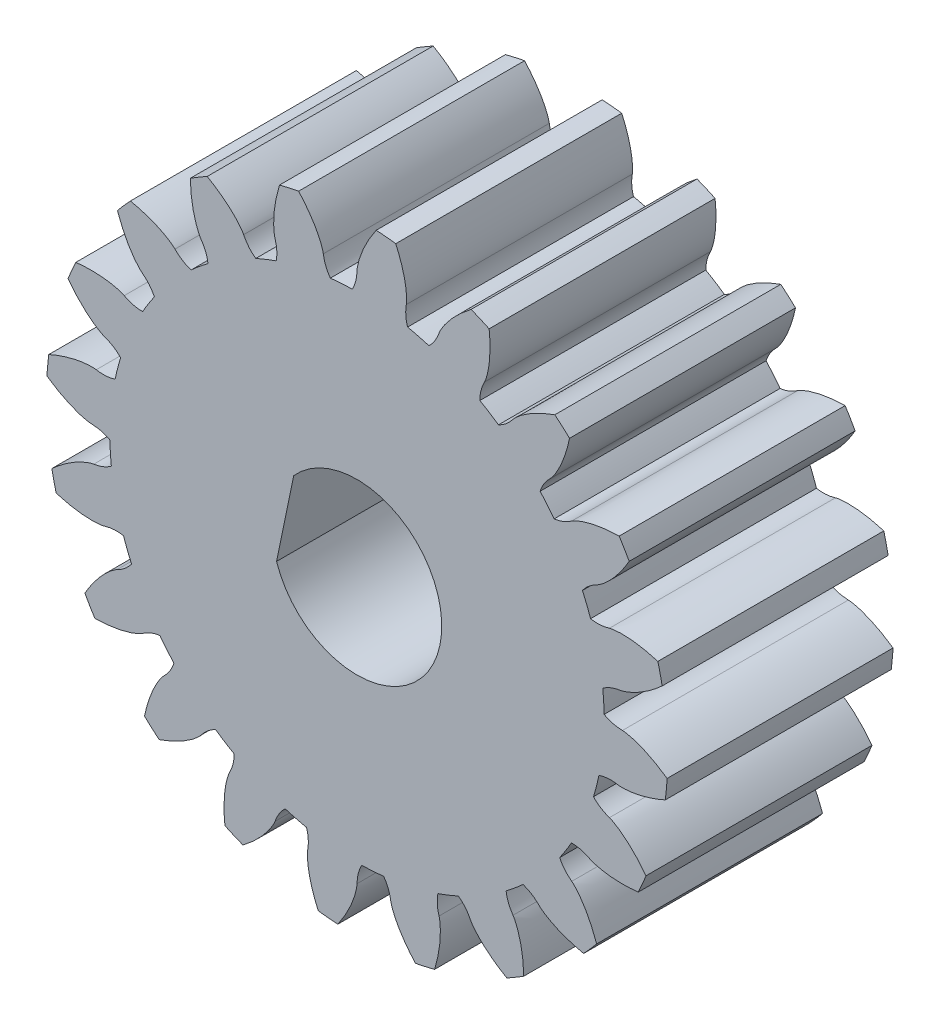
from build123d import *

# Parameters (mm, degrees)
EXTRUDE_1_DEPTH     = 8
SKETCH_5_R          = 1
CUT_EXTRUDE_1_DEPTH = 18.466428465
CUT_EXTRUDE_2_DEPTH = 18.466428465


with BuildPart() as part:
    # 草图4 → 凸台-拉伸1 (new body)
    with BuildSketch(Plane.XY):
        with BuildLine():
            ThreePointArc((2.543905939, 8.372039332), (2.169123392, 8.476874643), (1.790049985, 8.564941392))
            add(Edge.make_bspline(
                [(1.745749063, 9.233340802), (1.707740284, 9.004921116), (1.717265608, 8.783030501), (1.790049985, 8.564941392)],
                knots=[0, 0, 0, 0, 1, 1, 1, 1], degree=3))
            add(Edge.make_bspline(
                [(1.745749063, 9.233340802), (1.746999875, 9.240857749), (1.749991316, 9.262019744), (1.753602304, 9.302312656), (1.756572018, 9.368303719), (1.756057467, 9.452623023), (1.750449874, 9.561647495), (1.73749906, 9.689919098), (1.716635619, 9.830441145), (1.686820894, 9.982561877), (1.650814565, 10.133435989), (1.60911474, 10.282912942), (1.562384587, 10.430760302), (1.499754659, 10.608275298), (1.444797811, 10.746961244), (1.401215275, 10.848621675), (1.371830669, 10.914122989)],
                knots=[0, 0, 0, 0, 0, 0.005376748, 0.015083688, 0.02853182, 0.046610139, 0.064854849, 0.092110525, 0.119476175, 0.146842495, 0.174208853, 0.201574955, 0.228941013, 0.256307345, 0.306946889, 0.306946889, 0.306946889, 0.306946889, 0.306946889], degree=4))
            ThreePointArc((1.371830669, 10.914122989), (1.026259185, 10.952022283), (0.679662663, 10.978982588))
            add(Edge.make_bspline(
                [(0, 9.396926208), (0.000167452, 9.404544671), (0.001159536, 9.425894016), (0.005096976, 9.466156338), (0.014438695, 9.531550312), (0.030609023, 9.61430616), (0.056373425, 9.720390918), (0.092928922, 9.844023533), (0.139535173, 9.978223333), (0.197091668, 10.122156946), (0.260500386, 10.263715372), (0.329243924, 10.40284323), (0.402627475, 10.539435336), (0.497145628, 10.702224771), (0.576910665, 10.828286604), (0.638620845, 10.920080582), (0.679662663, 10.978982588)],
                knots=[0, 0, 0, 0, 0, 0.005376748, 0.015083688, 0.02853182, 0.046610139, 0.064854849, 0.092110525, 0.119476175, 0.146842495, 0.174208853, 0.201574955, 0.228941013, 0.256307345, 0.306946889, 0.306946889, 0.306946889, 0.306946889, 0.306946889], degree=4))
            add(Edge.make_bspline(
                [(0, 9.396926208), (-0.005088413, 9.165421719), (-0.055670474, 8.949163467), (-0.16770411, 8.748392728)],
                knots=[0, 0, 0, 0, 1, 1, 1, 1], degree=3))
            ThreePointArc((-0.16770411, 8.748392728), (-0.556539387, 8.732282858), (-0.944273743, 8.698899189))
            add(Edge.make_bspline(
                [(-1.1929532, 9.320895065), (-1.158516132, 9.091909676), (-1.08088904, 8.883822648), (-0.944273743, 8.698899189)],
                knots=[0, 0, 0, 0, 1, 1, 1, 1], degree=3))
            add(Edge.make_bspline(
                [(-1.1929532, 9.320895065), (-1.194086472, 9.328430628), (-1.197780859, 9.349481288), (-1.2067978, 9.388917981), (-1.224365793, 9.452596904), (-1.250911259, 9.532630323), (-1.289934811, 9.634585915), (-1.341889872, 9.752577437), (-1.405155885, 9.879774688), (-1.480519264, 10.015236845), (-1.561385983, 10.147600085), (-1.647235792, 10.276875161), (-1.737366156, 10.403045944), (-1.851785907, 10.552519025), (-1.946909289, 10.667434599), (-2.019773545, 10.75065167), (-2.067960985, 10.803866778)],
                knots=[0, 0, 0, 0, 0, 0.005376748, 0.015083688, 0.02853182, 0.046610139, 0.064854849, 0.092110525, 0.119476175, 0.146842495, 0.174208853, 0.201574955, 0.228941013, 0.256307345, 0.306946889, 0.306946889, 0.306946889, 0.306946889, 0.306946889], degree=4))
            ThreePointArc((-2.067960985, 10.803866778), (-2.408330523, 10.733123688), (-2.746294596, 10.651660246))
            add(Edge.make_bspline(
                [(-2.903809893, 8.937007903), (-2.906004871, 8.944305237), (-2.911658654, 8.964916242), (-2.920355668, 9.004424721), (-2.931679014, 9.069504836), (-2.941873082, 9.153207231), (-2.950151673, 9.26206147), (-2.953589908, 9.390939344), (-2.950734748, 9.532973062), (-2.940473201, 9.687647997), (-2.923911886, 9.841872432), (-2.901525769, 9.995433809), (-2.873943146, 10.148017386), (-2.834355743, 10.332047055), (-2.797449934, 10.476587735), (-2.767125964, 10.58295849), (-2.746294596, 10.651660246)],
                knots=[0, 0, 0, 0, 0, 0.005376748, 0.015083688, 0.02853182, 0.046610139, 0.064854849, 0.092110525, 0.119476175, 0.146842495, 0.174208853, 0.201574955, 0.228941013, 0.256307345, 0.306946889, 0.306946889, 0.306946889, 0.306946889, 0.306946889], degree=4))
            add(Edge.make_bspline(
                [(-2.903809893, 8.937007903), (-2.83711044, 8.715261644), (-2.818389364, 8.493957108), (-2.862898114, 8.268392491)],
                knots=[0, 0, 0, 0, 1, 1, 1, 1], degree=3))
            ThreePointArc((-2.862898114, 8.268392491), (-3.227724213, 8.132914385), (-3.586165378, 7.981348124))
            add(Edge.make_bspline(
                [(-4.014880893, 8.496055177), (-3.911368918, 8.28891877), (-3.773238738, 8.115004336), (-3.586165378, 7.981348124)],
                knots=[0, 0, 0, 0, 1, 1, 1, 1], degree=3))
            add(Edge.make_bspline(
                [(-4.014880893, 8.496055177), (-4.018287315, 8.502871723), (-4.028305898, 8.521750462), (-4.049068126, 8.556470598), (-4.08545415, 8.611604044), (-4.135432075, 8.679517349), (-4.204051689, 8.764423938), (-4.289925274, 8.860585548), (-4.38940094, 8.962007049), (-4.502935881, 9.067550651), (-4.620747192, 9.168446383), (-4.742343408, 9.264865235), (-4.867051393, 9.357008967), (-5.022060766, 9.463808667), (-5.148039343, 9.543705131), (-5.243052858, 9.600332975), (-5.30532621, 9.636052813)],
                knots=[0, 0, 0, 0, 0, 0.005376748, 0.015083688, 0.02853182, 0.046610139, 0.064854849, 0.092110525, 0.119476175, 0.146842495, 0.174208853, 0.201574955, 0.228941013, 0.256307345, 0.306946889, 0.306946889, 0.306946889, 0.306946889, 0.306946889], degree=4))
            ThreePointArc((-5.30532621, 9.636052813), (-5.607176059, 9.463592164), (-5.903425405, 9.281679185))
            add(Edge.make_bspline(
                [(-5.523374642, 7.602272997), (-5.52771719, 7.608534889), (-5.539463408, 7.626390005), (-5.559943551, 7.661277276), (-5.590823555, 7.719673037), (-5.626384152, 7.796128605), (-5.66789537, 7.897096913), (-5.710990779, 8.018604581), (-5.752166193, 8.154568967), (-5.790204066, 8.304844564), (-5.82211129, 8.456638446), (-5.848273903, 8.609601685), (-5.869192188, 8.76324079), (-5.888410625, 8.950496586), (-5.897976642, 9.099367463), (-5.902007203, 9.209902685), (-5.903425405, 9.281679185)],
                knots=[0, 0, 0, 0, 0, 0.005376748, 0.015083688, 0.02853182, 0.046610139, 0.064854849, 0.092110525, 0.119476175, 0.146842495, 0.174208853, 0.201574955, 0.228941013, 0.256307345, 0.306946889, 0.306946889, 0.306946889, 0.306946889, 0.306946889], degree=4))
            add(Edge.make_bspline(
                [(-5.523374642, 7.602272997), (-5.39141633, 7.411991037), (-5.305224666, 7.207303046), (-5.277851702, 6.979024388)],
                knots=[0, 0, 0, 0, 1, 1, 1, 1], degree=3))
            ThreePointArc((-5.277851702, 6.979024388), (-5.582956905, 6.737439588), (-5.87701816, 6.482527096))
            add(Edge.make_bspline(
                [(-6.44380407, 6.839562213), (-6.281349662, 6.674550742), (-6.096237539, 6.55183286), (-5.87701816, 6.482527096)],
                knots=[0, 0, 0, 0, 1, 1, 1, 1], degree=3))
            add(Edge.make_bspline(
                [(-6.44380407, 6.839562213), (-6.449150199, 6.844992491), (-6.464512288, 6.859851327), (-6.494987453, 6.886456257), (-6.54662979, 6.927647379), (-6.615147986, 6.976792743), (-6.706646696, 7.036339081), (-6.8180329, 7.101257809), (-6.943980848, 7.166975717), (-7.084573761, 7.232269421), (-7.227797471, 7.291821267), (-7.373237409, 7.345945749), (-7.52031573, 7.395042758), (-7.700741326, 7.448714778), (-7.845243438, 7.485771309), (-7.953105627, 7.510266799), (-8.023369141, 7.524994859)],
                knots=[0, 0, 0, 0, 0, 0.005376748, 0.015083688, 0.02853182, 0.046610139, 0.064854849, 0.092110525, 0.119476175, 0.146842495, 0.174208853, 0.201574955, 0.228941013, 0.256307345, 0.306946889, 0.306946889, 0.306946889, 0.306946889, 0.306946889], degree=4))
            ThreePointArc((-8.023369141, 7.524994859), (-8.257152136, 7.267698302), (-8.482687804, 7.003142695))
            add(Edge.make_bspline(
                [(-7.602272997, 5.523374642), (-7.608338037, 5.527988134), (-7.625026888, 5.541339577), (-7.655285421, 5.568190631), (-7.702699333, 5.614185854), (-7.76014554, 5.675910591), (-7.830825977, 5.759109487), (-7.909360081, 5.861352933), (-7.990535534, 5.977938845), (-8.073149413, 6.109105083), (-8.150401876, 6.243609769), (-8.22255224, 6.381001762), (-8.289923805, 6.520657128), (-8.366066849, 6.692809149), (-8.421168302, 6.831437705), (-8.459158856, 6.935317436), (-8.482687804, 7.003142695)],
                knots=[0, 0, 0, 0, 0, 0.005376748, 0.015083688, 0.02853182, 0.046610139, 0.064854849, 0.092110525, 0.119476175, 0.146842495, 0.174208853, 0.201574955, 0.228941013, 0.256307345, 0.306946889, 0.306946889, 0.306946889, 0.306946889, 0.306946889], degree=4))
            add(Edge.make_bspline(
                [(-7.602272997, 5.523374642), (-7.417972826, 5.383183105), (-7.272747614, 5.215147946), (-7.176172394, 5.006500752)],
                knots=[0, 0, 0, 0, 1, 1, 1, 1], degree=3))
            ThreePointArc((-7.176172394, 5.006500752), (-7.391690876, 4.682457261), (-7.592587457, 4.349151149))
            add(Edge.make_bspline(
                [(-8.241962808, 4.513565245), (-8.036468136, 4.406831183), (-7.822494134, 4.347322334), (-7.592587457, 4.349151149)],
                knots=[0, 0, 0, 0, 1, 1, 1, 1], degree=3))
            add(Edge.make_bspline(
                [(-8.241962808, 4.513565245), (-8.248725327, 4.517077702), (-8.267927175, 4.526462148), (-8.305132155, 4.542347596), (-8.366975693, 4.565564322), (-8.447327122, 4.591131053), (-8.552748397, 4.619488329), (-8.678743963, 4.646809479), (-8.81883553, 4.670390867), (-8.9727242, 4.689043271), (-9.127340575, 4.701421882), (-9.28238756, 4.70795391), (-9.437439166, 4.70919824), (-9.625619671, 4.704488789), (-9.774500445, 4.695078036), (-9.884653004, 4.685043381), (-9.956028798, 4.677337979)],
                knots=[0, 0, 0, 0, 0, 0.005376748, 0.015083688, 0.02853182, 0.046610139, 0.064854849, 0.092110525, 0.119476175, 0.146842495, 0.174208853, 0.201574955, 0.228941013, 0.256307345, 0.306946889, 0.306946889, 0.306946889, 0.306946889, 0.306946889], degree=4))
            ThreePointArc((-9.956028798, 4.677337979), (-10.09886063, 4.360391494), (-10.231605619, 4.039089805))
            add(Edge.make_bspline(
                [(-8.937007903, 2.903809893), (-8.944201746, 2.906323384), (-8.96419961, 2.913864223), (-9.001274617, 2.930050692), (-9.060581232, 2.959143044), (-9.134289815, 3.000094903), (-9.227220778, 3.057380299), (-9.333506111, 3.130351221), (-9.446735583, 3.216146419), (-9.565838647, 3.315363831), (-9.680874339, 3.419413065), (-9.791949874, 3.527784927), (-9.899179922, 3.639786114), (-10.02479416, 3.779982921), (-10.120037336, 3.894799228), (-10.188269102, 3.981854996), (-10.231605619, 4.039089805)],
                knots=[0, 0, 0, 0, 0, 0.005376748, 0.015083688, 0.02853182, 0.046610139, 0.064854849, 0.092110525, 0.119476175, 0.146842495, 0.174208853, 0.201574955, 0.228941013, 0.256307345, 0.306946889, 0.306946889, 0.306946889, 0.306946889, 0.306946889], degree=4))
            add(Edge.make_bspline(
                [(-8.937007903, 2.903809893), (-8.718406457, 2.827431703), (-8.528363353, 2.712497829), (-8.372039332, 2.543905939)],
                knots=[0, 0, 0, 0, 1, 1, 1, 1], degree=3))
            ThreePointArc((-8.372039332, 2.543905939), (-8.476874643, 2.169123392), (-8.564941392, 1.790049985))
            add(Edge.make_bspline(
                [(-9.233340802, 1.745749063), (-9.004921116, 1.707740284), (-8.783030501, 1.717265608), (-8.564941392, 1.790049985)],
                knots=[0, 0, 0, 0, 1, 1, 1, 1], degree=3))
            add(Edge.make_bspline(
                [(-9.233340802, 1.745749063), (-9.240857749, 1.746999875), (-9.262019744, 1.749991316), (-9.302312656, 1.753602304), (-9.368303719, 1.756572018), (-9.452623023, 1.756057467), (-9.561647495, 1.750449874), (-9.689919098, 1.73749906), (-9.830441145, 1.716635619), (-9.982561877, 1.686820894), (-10.133435989, 1.650814565), (-10.282912942, 1.60911474), (-10.430760302, 1.562384587), (-10.608275298, 1.499754659), (-10.746961244, 1.444797811), (-10.848621675, 1.401215275), (-10.914122989, 1.371830669)],
                knots=[0, 0, 0, 0, 0, 0.005376748, 0.015083688, 0.02853182, 0.046610139, 0.064854849, 0.092110525, 0.119476175, 0.146842495, 0.174208853, 0.201574955, 0.228941013, 0.256307345, 0.306946889, 0.306946889, 0.306946889, 0.306946889, 0.306946889], degree=4))
            ThreePointArc((-10.914122989, 1.371830669), (-10.952022283, 1.026259185), (-10.978982588, 0.679662663))
            add(Edge.make_bspline(
                [(-9.396926208, 0), (-9.404544671, 0.000167452), (-9.425894016, 0.001159536), (-9.466156338, 0.005096976), (-9.531550312, 0.014438695), (-9.61430616, 0.030609023), (-9.720390918, 0.056373425), (-9.844023533, 0.092928922), (-9.978223333, 0.139535173), (-10.122156946, 0.197091668), (-10.263715372, 0.260500386), (-10.40284323, 0.329243924), (-10.539435336, 0.402627475), (-10.702224771, 0.497145628), (-10.828286604, 0.576910665), (-10.920080582, 0.638620845), (-10.978982588, 0.679662663)],
                knots=[0, 0, 0, 0, 0, 0.005376748, 0.015083688, 0.02853182, 0.046610139, 0.064854849, 0.092110525, 0.119476175, 0.146842495, 0.174208853, 0.201574955, 0.228941013, 0.256307345, 0.306946889, 0.306946889, 0.306946889, 0.306946889, 0.306946889], degree=4))
            add(Edge.make_bspline(
                [(-9.396926208, 0), (-9.165421719, -0.005088413), (-8.949163467, -0.055670474), (-8.748392728, -0.16770411)],
                knots=[0, 0, 0, 0, 1, 1, 1, 1], degree=3))
            ThreePointArc((-8.748392728, -0.16770411), (-8.732282858, -0.556539387), (-8.698899189, -0.944273743))
            add(Edge.make_bspline(
                [(-9.320895065, -1.1929532), (-9.091909676, -1.158516132), (-8.883822648, -1.08088904), (-8.698899189, -0.944273743)],
                knots=[0, 0, 0, 0, 1, 1, 1, 1], degree=3))
            add(Edge.make_bspline(
                [(-9.320895065, -1.1929532), (-9.328430628, -1.194086472), (-9.349481288, -1.197780859), (-9.388917981, -1.2067978), (-9.452596904, -1.224365793), (-9.532630323, -1.250911259), (-9.634585915, -1.289934811), (-9.752577437, -1.341889872), (-9.879774688, -1.405155885), (-10.015236845, -1.480519264), (-10.147600085, -1.561385983), (-10.276875161, -1.647235792), (-10.403045944, -1.737366156), (-10.552519025, -1.851785907), (-10.667434599, -1.946909289), (-10.75065167, -2.019773545), (-10.803866778, -2.067960985)],
                knots=[0, 0, 0, 0, 0, 0.005376748, 0.015083688, 0.02853182, 0.046610139, 0.064854849, 0.092110525, 0.119476175, 0.146842495, 0.174208853, 0.201574955, 0.228941013, 0.256307345, 0.306946889, 0.306946889, 0.306946889, 0.306946889, 0.306946889], degree=4))
            ThreePointArc((-10.803866778, -2.067960985), (-10.733123688, -2.408330523), (-10.651660246, -2.746294596))
            add(Edge.make_bspline(
                [(-8.937007903, -2.903809893), (-8.944305237, -2.906004871), (-8.964916242, -2.911658654), (-9.004424721, -2.920355668), (-9.069504836, -2.931679014), (-9.153207231, -2.941873082), (-9.26206147, -2.950151673), (-9.390939344, -2.953589908), (-9.532973062, -2.950734748), (-9.687647997, -2.940473201), (-9.841872432, -2.923911886), (-9.995433809, -2.901525769), (-10.148017386, -2.873943146), (-10.332047055, -2.834355743), (-10.476587735, -2.797449934), (-10.58295849, -2.767125964), (-10.651660246, -2.746294596)],
                knots=[0, 0, 0, 0, 0, 0.005376748, 0.015083688, 0.02853182, 0.046610139, 0.064854849, 0.092110525, 0.119476175, 0.146842495, 0.174208853, 0.201574955, 0.228941013, 0.256307345, 0.306946889, 0.306946889, 0.306946889, 0.306946889, 0.306946889], degree=4))
            add(Edge.make_bspline(
                [(-8.937007903, -2.903809893), (-8.715261644, -2.83711044), (-8.493957108, -2.818389364), (-8.268392491, -2.862898114)],
                knots=[0, 0, 0, 0, 1, 1, 1, 1], degree=3))
            ThreePointArc((-8.268392491, -2.862898114), (-8.132914385, -3.227724213), (-7.981348124, -3.586165378))
            add(Edge.make_bspline(
                [(-8.496055177, -4.014880893), (-8.28891877, -3.911368918), (-8.115004336, -3.773238738), (-7.981348124, -3.586165378)],
                knots=[0, 0, 0, 0, 1, 1, 1, 1], degree=3))
            add(Edge.make_bspline(
                [(-8.496055177, -4.014880893), (-8.502871723, -4.018287315), (-8.521750462, -4.028305898), (-8.556470598, -4.049068126), (-8.611604044, -4.08545415), (-8.679517349, -4.135432075), (-8.764423938, -4.204051689), (-8.860585548, -4.289925274), (-8.962007049, -4.38940094), (-9.067550651, -4.502935881), (-9.168446383, -4.620747192), (-9.264865235, -4.742343408), (-9.357008967, -4.867051393), (-9.463808667, -5.022060766), (-9.543705131, -5.148039343), (-9.600332975, -5.243052858), (-9.636052813, -5.30532621)],
                knots=[0, 0, 0, 0, 0, 0.005376748, 0.015083688, 0.02853182, 0.046610139, 0.064854849, 0.092110525, 0.119476175, 0.146842495, 0.174208853, 0.201574955, 0.228941013, 0.256307345, 0.306946889, 0.306946889, 0.306946889, 0.306946889, 0.306946889], degree=4))
            ThreePointArc((-9.636052813, -5.30532621), (-9.463592164, -5.607176059), (-9.281679185, -5.903425405))
            add(Edge.make_bspline(
                [(-7.602272997, -5.523374642), (-7.608534889, -5.52771719), (-7.626390005, -5.539463408), (-7.661277276, -5.559943551), (-7.719673037, -5.590823555), (-7.796128605, -5.626384152), (-7.897096913, -5.66789537), (-8.018604581, -5.710990779), (-8.154568967, -5.752166193), (-8.304844564, -5.790204066), (-8.456638446, -5.82211129), (-8.609601685, -5.848273903), (-8.76324079, -5.869192188), (-8.950496586, -5.888410625), (-9.099367463, -5.897976642), (-9.209902685, -5.902007203), (-9.281679185, -5.903425405)],
                knots=[0, 0, 0, 0, 0, 0.005376748, 0.015083688, 0.02853182, 0.046610139, 0.064854849, 0.092110525, 0.119476175, 0.146842495, 0.174208853, 0.201574955, 0.228941013, 0.256307345, 0.306946889, 0.306946889, 0.306946889, 0.306946889, 0.306946889], degree=4))
            add(Edge.make_bspline(
                [(-7.602272997, -5.523374642), (-7.411991037, -5.39141633), (-7.207303046, -5.305224666), (-6.979024388, -5.277851702)],
                knots=[0, 0, 0, 0, 1, 1, 1, 1], degree=3))
            ThreePointArc((-6.979024388, -5.277851702), (-6.737439588, -5.582956905), (-6.482527096, -5.87701816))
            add(Edge.make_bspline(
                [(-6.839562213, -6.44380407), (-6.674550742, -6.281349662), (-6.55183286, -6.096237539), (-6.482527096, -5.87701816)],
                knots=[0, 0, 0, 0, 1, 1, 1, 1], degree=3))
            add(Edge.make_bspline(
                [(-6.839562213, -6.44380407), (-6.844992491, -6.449150199), (-6.859851327, -6.464512288), (-6.886456257, -6.494987453), (-6.927647379, -6.54662979), (-6.976792743, -6.615147986), (-7.036339081, -6.706646696), (-7.101257809, -6.8180329), (-7.166975717, -6.943980848), (-7.232269421, -7.084573761), (-7.291821267, -7.227797471), (-7.345945749, -7.373237409), (-7.395042758, -7.52031573), (-7.448714778, -7.700741326), (-7.485771309, -7.845243438), (-7.510266799, -7.953105627), (-7.524994859, -8.023369141)],
                knots=[0, 0, 0, 0, 0, 0.005376748, 0.015083688, 0.02853182, 0.046610139, 0.064854849, 0.092110525, 0.119476175, 0.146842495, 0.174208853, 0.201574955, 0.228941013, 0.256307345, 0.306946889, 0.306946889, 0.306946889, 0.306946889, 0.306946889], degree=4))
            ThreePointArc((-7.524994859, -8.023369141), (-7.267698302, -8.257152136), (-7.003142695, -8.482687804))
            add(Edge.make_bspline(
                [(-5.523374642, -7.602272997), (-5.527988134, -7.608338037), (-5.541339577, -7.625026888), (-5.568190631, -7.655285421), (-5.614185854, -7.702699333), (-5.675910591, -7.76014554), (-5.759109487, -7.830825977), (-5.861352933, -7.909360081), (-5.977938845, -7.990535534), (-6.109105083, -8.073149413), (-6.243609769, -8.150401876), (-6.381001762, -8.22255224), (-6.520657128, -8.289923805), (-6.692809149, -8.366066849), (-6.831437705, -8.421168302), (-6.935317436, -8.459158856), (-7.003142695, -8.482687804)],
                knots=[0, 0, 0, 0, 0, 0.005376748, 0.015083688, 0.02853182, 0.046610139, 0.064854849, 0.092110525, 0.119476175, 0.146842495, 0.174208853, 0.201574955, 0.228941013, 0.256307345, 0.306946889, 0.306946889, 0.306946889, 0.306946889, 0.306946889], degree=4))
            add(Edge.make_bspline(
                [(-5.523374642, -7.602272997), (-5.383183105, -7.417972826), (-5.215147946, -7.272747614), (-5.006500752, -7.176172394)],
                knots=[0, 0, 0, 0, 1, 1, 1, 1], degree=3))
            ThreePointArc((-5.006500752, -7.176172394), (-4.68245726, -7.391690876), (-4.349151149, -7.592587457))
            add(Edge.make_bspline(
                [(-4.513565245, -8.241962808), (-4.406831183, -8.036468136), (-4.347322334, -7.822494134), (-4.349151149, -7.592587457)],
                knots=[0, 0, 0, 0, 1, 1, 1, 1], degree=3))
            add(Edge.make_bspline(
                [(-4.513565245, -8.241962808), (-4.517077702, -8.248725327), (-4.526462148, -8.267927175), (-4.542347596, -8.305132155), (-4.565564322, -8.366975693), (-4.591131053, -8.447327122), (-4.619488329, -8.552748397), (-4.646809479, -8.678743963), (-4.670390867, -8.81883553), (-4.689043271, -8.9727242), (-4.701421882, -9.127340575), (-4.70795391, -9.28238756), (-4.70919824, -9.437439166), (-4.704488789, -9.625619671), (-4.695078036, -9.774500445), (-4.685043381, -9.884653004), (-4.677337979, -9.956028798)],
                knots=[0, 0, 0, 0, 0, 0.005376748, 0.015083688, 0.02853182, 0.046610139, 0.064854849, 0.092110525, 0.119476175, 0.146842495, 0.174208853, 0.201574955, 0.228941013, 0.256307345, 0.306946889, 0.306946889, 0.306946889, 0.306946889, 0.306946889], degree=4))
            ThreePointArc((-4.677337979, -9.956028798), (-4.360391494, -10.09886063), (-4.039089805, -10.231605619))
            add(Edge.make_bspline(
                [(-2.903809893, -8.937007903), (-2.906323384, -8.944201746), (-2.913864223, -8.96419961), (-2.930050692, -9.001274617), (-2.959143044, -9.060581232), (-3.000094903, -9.134289815), (-3.057380299, -9.227220778), (-3.130351221, -9.333506111), (-3.216146419, -9.446735583), (-3.315363831, -9.565838647), (-3.419413065, -9.680874339), (-3.527784927, -9.791949874), (-3.639786114, -9.899179922), (-3.779982921, -10.02479416), (-3.894799228, -10.120037336), (-3.981854996, -10.188269102), (-4.039089805, -10.231605619)],
                knots=[0, 0, 0, 0, 0, 0.005376748, 0.015083688, 0.02853182, 0.046610139, 0.064854849, 0.092110525, 0.119476175, 0.146842495, 0.174208853, 0.201574955, 0.228941013, 0.256307345, 0.306946889, 0.306946889, 0.306946889, 0.306946889, 0.306946889], degree=4))
            add(Edge.make_bspline(
                [(-2.903809893, -8.937007903), (-2.827431703, -8.718406457), (-2.712497829, -8.528363353), (-2.543905939, -8.372039332)],
                knots=[0, 0, 0, 0, 1, 1, 1, 1], degree=3))
            ThreePointArc((-2.543905939, -8.372039332), (-2.169123392, -8.476874643), (-1.790049985, -8.564941392))
            add(Edge.make_bspline(
                [(-1.745749063, -9.233340802), (-1.707740284, -9.004921116), (-1.717265608, -8.783030501), (-1.790049985, -8.564941392)],
                knots=[0, 0, 0, 0, 1, 1, 1, 1], degree=3))
            add(Edge.make_bspline(
                [(-1.745749063, -9.233340802), (-1.746999875, -9.240857749), (-1.749991316, -9.262019744), (-1.753602304, -9.302312656), (-1.756572018, -9.368303719), (-1.756057467, -9.452623023), (-1.750449874, -9.561647495), (-1.73749906, -9.689919098), (-1.716635619, -9.830441145), (-1.686820894, -9.982561877), (-1.650814565, -10.133435989), (-1.60911474, -10.282912942), (-1.562384587, -10.430760302), (-1.499754659, -10.608275298), (-1.444797811, -10.746961244), (-1.401215275, -10.848621675), (-1.371830669, -10.914122989)],
                knots=[0, 0, 0, 0, 0, 0.005376748, 0.015083688, 0.02853182, 0.046610139, 0.064854849, 0.092110525, 0.119476175, 0.146842495, 0.174208853, 0.201574955, 0.228941013, 0.256307345, 0.306946889, 0.306946889, 0.306946889, 0.306946889, 0.306946889], degree=4))
            ThreePointArc((-1.371830669, -10.914122989), (-1.026259185, -10.952022283), (-0.679662663, -10.978982588))
            add(Edge.make_bspline(
                [(0, -9.396926208), (-0.000167452, -9.404544671), (-0.001159536, -9.425894016), (-0.005096976, -9.466156338), (-0.014438695, -9.531550312), (-0.030609023, -9.61430616), (-0.056373425, -9.720390918), (-0.092928922, -9.844023533), (-0.139535173, -9.978223333), (-0.197091668, -10.122156946), (-0.260500386, -10.263715372), (-0.329243924, -10.40284323), (-0.402627475, -10.539435336), (-0.497145628, -10.702224771), (-0.576910665, -10.828286604), (-0.638620845, -10.920080582), (-0.679662663, -10.978982588)],
                knots=[0, 0, 0, 0, 0, 0.005376748, 0.015083688, 0.02853182, 0.046610139, 0.064854849, 0.092110525, 0.119476175, 0.146842495, 0.174208853, 0.201574955, 0.228941013, 0.256307345, 0.306946889, 0.306946889, 0.306946889, 0.306946889, 0.306946889], degree=4))
            add(Edge.make_bspline(
                [(0, -9.396926208), (0.005088413, -9.165421719), (0.055670474, -8.949163467), (0.16770411, -8.748392728)],
                knots=[0, 0, 0, 0, 1, 1, 1, 1], degree=3))
            ThreePointArc((0.16770411, -8.748392728), (0.556539387, -8.732282858), (0.944273743, -8.698899189))
            add(Edge.make_bspline(
                [(1.1929532, -9.320895065), (1.158516132, -9.091909676), (1.08088904, -8.883822648), (0.944273743, -8.698899189)],
                knots=[0, 0, 0, 0, 1, 1, 1, 1], degree=3))
            add(Edge.make_bspline(
                [(1.1929532, -9.320895065), (1.194086472, -9.328430628), (1.197780859, -9.349481288), (1.2067978, -9.388917981), (1.224365793, -9.452596904), (1.250911259, -9.532630323), (1.289934811, -9.634585915), (1.341889872, -9.752577437), (1.405155885, -9.879774688), (1.480519264, -10.015236845), (1.561385983, -10.147600085), (1.647235792, -10.276875161), (1.737366156, -10.403045944), (1.851785907, -10.552519025), (1.946909289, -10.667434599), (2.019773545, -10.75065167), (2.067960985, -10.803866778)],
                knots=[0, 0, 0, 0, 0, 0.005376748, 0.015083688, 0.02853182, 0.046610139, 0.064854849, 0.092110525, 0.119476175, 0.146842495, 0.174208853, 0.201574955, 0.228941013, 0.256307345, 0.306946889, 0.306946889, 0.306946889, 0.306946889, 0.306946889], degree=4))
            ThreePointArc((2.067960985, -10.803866778), (2.408330523, -10.733123688), (2.746294596, -10.651660246))
            add(Edge.make_bspline(
                [(2.903809893, -8.937007903), (2.906004871, -8.944305237), (2.911658654, -8.964916242), (2.920355668, -9.004424721), (2.931679014, -9.069504836), (2.941873082, -9.153207231), (2.950151673, -9.26206147), (2.953589908, -9.390939344), (2.950734748, -9.532973062), (2.940473201, -9.687647997), (2.923911886, -9.841872432), (2.901525769, -9.995433809), (2.873943146, -10.148017386), (2.834355743, -10.332047055), (2.797449934, -10.476587735), (2.767125964, -10.58295849), (2.746294596, -10.651660246)],
                knots=[0, 0, 0, 0, 0, 0.005376748, 0.015083688, 0.02853182, 0.046610139, 0.064854849, 0.092110525, 0.119476175, 0.146842495, 0.174208853, 0.201574955, 0.228941013, 0.256307345, 0.306946889, 0.306946889, 0.306946889, 0.306946889, 0.306946889], degree=4))
            add(Edge.make_bspline(
                [(2.903809893, -8.937007903), (2.83711044, -8.715261644), (2.818389364, -8.493957108), (2.862898114, -8.268392491)],
                knots=[0, 0, 0, 0, 1, 1, 1, 1], degree=3))
            ThreePointArc((2.862898114, -8.268392491), (3.227724213, -8.132914385), (3.586165378, -7.981348124))
            add(Edge.make_bspline(
                [(4.014880893, -8.496055177), (3.911368918, -8.28891877), (3.773238738, -8.115004336), (3.586165378, -7.981348124)],
                knots=[0, 0, 0, 0, 1, 1, 1, 1], degree=3))
            add(Edge.make_bspline(
                [(4.014880893, -8.496055177), (4.018287315, -8.502871723), (4.028305898, -8.521750462), (4.049068126, -8.556470598), (4.08545415, -8.611604044), (4.135432075, -8.679517349), (4.204051689, -8.764423938), (4.289925274, -8.860585548), (4.38940094, -8.962007049), (4.502935881, -9.067550651), (4.620747192, -9.168446383), (4.742343408, -9.264865235), (4.867051393, -9.357008967), (5.022060766, -9.463808667), (5.148039343, -9.543705131), (5.243052858, -9.600332975), (5.30532621, -9.636052813)],
                knots=[0, 0, 0, 0, 0, 0.005376748, 0.015083688, 0.02853182, 0.046610139, 0.064854849, 0.092110525, 0.119476175, 0.146842495, 0.174208853, 0.201574955, 0.228941013, 0.256307345, 0.306946889, 0.306946889, 0.306946889, 0.306946889, 0.306946889], degree=4))
            ThreePointArc((5.30532621, -9.636052813), (5.607176059, -9.463592164), (5.903425405, -9.281679185))
            add(Edge.make_bspline(
                [(5.523374642, -7.602272997), (5.52771719, -7.608534889), (5.539463408, -7.626390005), (5.559943551, -7.661277276), (5.590823555, -7.719673037), (5.626384152, -7.796128605), (5.66789537, -7.897096913), (5.710990779, -8.018604581), (5.752166193, -8.154568967), (5.790204066, -8.304844564), (5.82211129, -8.456638446), (5.848273903, -8.609601685), (5.869192188, -8.76324079), (5.888410625, -8.950496586), (5.897976642, -9.099367463), (5.902007203, -9.209902685), (5.903425405, -9.281679185)],
                knots=[0, 0, 0, 0, 0, 0.005376748, 0.015083688, 0.02853182, 0.046610139, 0.064854849, 0.092110525, 0.119476175, 0.146842495, 0.174208853, 0.201574955, 0.228941013, 0.256307345, 0.306946889, 0.306946889, 0.306946889, 0.306946889, 0.306946889], degree=4))
            add(Edge.make_bspline(
                [(5.523374642, -7.602272997), (5.39141633, -7.411991037), (5.305224666, -7.207303046), (5.277851702, -6.979024388)],
                knots=[0, 0, 0, 0, 1, 1, 1, 1], degree=3))
            ThreePointArc((5.277851702, -6.979024388), (5.582956905, -6.737439588), (5.87701816, -6.482527096))
            add(Edge.make_bspline(
                [(6.44380407, -6.839562213), (6.281349662, -6.674550742), (6.096237539, -6.55183286), (5.87701816, -6.482527096)],
                knots=[0, 0, 0, 0, 1, 1, 1, 1], degree=3))
            add(Edge.make_bspline(
                [(6.44380407, -6.839562213), (6.449150199, -6.844992491), (6.464512288, -6.859851327), (6.494987453, -6.886456257), (6.54662979, -6.927647379), (6.615147986, -6.976792743), (6.706646696, -7.036339081), (6.8180329, -7.101257809), (6.943980848, -7.166975717), (7.084573761, -7.232269421), (7.227797471, -7.291821267), (7.373237409, -7.345945749), (7.52031573, -7.395042758), (7.700741326, -7.448714778), (7.845243438, -7.485771309), (7.953105627, -7.510266799), (8.023369141, -7.524994859)],
                knots=[0, 0, 0, 0, 0, 0.005376748, 0.015083688, 0.02853182, 0.046610139, 0.064854849, 0.092110525, 0.119476175, 0.146842495, 0.174208853, 0.201574955, 0.228941013, 0.256307345, 0.306946889, 0.306946889, 0.306946889, 0.306946889, 0.306946889], degree=4))
            ThreePointArc((8.023369141, -7.524994859), (8.257152136, -7.267698302), (8.482687804, -7.003142695))
            add(Edge.make_bspline(
                [(7.602272997, -5.523374642), (7.608338037, -5.527988133), (7.625026888, -5.541339577), (7.655285421, -5.568190631), (7.702699333, -5.614185854), (7.76014554, -5.675910591), (7.830825977, -5.759109487), (7.909360081, -5.861352933), (7.990535534, -5.977938845), (8.073149413, -6.109105083), (8.150401876, -6.243609769), (8.22255224, -6.381001762), (8.289923805, -6.520657128), (8.366066849, -6.692809149), (8.421168302, -6.831437705), (8.459158856, -6.935317436), (8.482687804, -7.003142695)],
                knots=[0, 0, 0, 0, 0, 0.005376748, 0.015083688, 0.02853182, 0.046610139, 0.064854849, 0.092110525, 0.119476175, 0.146842495, 0.174208853, 0.201574955, 0.228941013, 0.256307345, 0.306946889, 0.306946889, 0.306946889, 0.306946889, 0.306946889], degree=4))
            add(Edge.make_bspline(
                [(7.602272997, -5.523374642), (7.417972826, -5.383183105), (7.272747614, -5.215147946), (7.176172394, -5.006500752)],
                knots=[0, 0, 0, 0, 1, 1, 1, 1], degree=3))
            ThreePointArc((7.176172394, -5.006500752), (7.391690876, -4.68245726), (7.592587457, -4.349151149))
            add(Edge.make_bspline(
                [(8.241962808, -4.513565245), (8.036468136, -4.406831183), (7.822494134, -4.347322334), (7.592587457, -4.349151149)],
                knots=[0, 0, 0, 0, 1, 1, 1, 1], degree=3))
            add(Edge.make_bspline(
                [(8.241962808, -4.513565245), (8.248725327, -4.517077702), (8.267927175, -4.526462148), (8.305132155, -4.542347596), (8.366975693, -4.565564322), (8.447327122, -4.591131053), (8.552748397, -4.619488329), (8.678743963, -4.646809479), (8.81883553, -4.670390867), (8.9727242, -4.689043271), (9.127340575, -4.701421882), (9.28238756, -4.70795391), (9.437439166, -4.70919824), (9.625619671, -4.704488789), (9.774500445, -4.695078036), (9.884653004, -4.685043381), (9.956028798, -4.677337979)],
                knots=[0, 0, 0, 0, 0, 0.005376748, 0.015083688, 0.02853182, 0.046610139, 0.064854849, 0.092110525, 0.119476175, 0.146842495, 0.174208853, 0.201574955, 0.228941013, 0.256307345, 0.306946889, 0.306946889, 0.306946889, 0.306946889, 0.306946889], degree=4))
            ThreePointArc((9.956028798, -4.677337979), (10.09886063, -4.360391494), (10.231605619, -4.039089805))
            add(Edge.make_bspline(
                [(8.937007903, -2.903809893), (8.944201746, -2.906323384), (8.96419961, -2.913864223), (9.001274617, -2.930050692), (9.060581232, -2.959143044), (9.134289815, -3.000094903), (9.227220778, -3.057380299), (9.333506111, -3.130351221), (9.446735583, -3.216146419), (9.565838647, -3.315363831), (9.680874339, -3.419413065), (9.791949874, -3.527784927), (9.899179922, -3.639786114), (10.02479416, -3.779982921), (10.120037336, -3.894799228), (10.188269102, -3.981854996), (10.231605619, -4.039089805)],
                knots=[0, 0, 0, 0, 0, 0.005376748, 0.015083688, 0.02853182, 0.046610139, 0.064854849, 0.092110525, 0.119476175, 0.146842495, 0.174208853, 0.201574955, 0.228941013, 0.256307345, 0.306946889, 0.306946889, 0.306946889, 0.306946889, 0.306946889], degree=4))
            add(Edge.make_bspline(
                [(8.937007903, -2.903809893), (8.718406457, -2.827431703), (8.528363353, -2.712497829), (8.372039332, -2.543905939)],
                knots=[0, 0, 0, 0, 1, 1, 1, 1], degree=3))
            ThreePointArc((8.372039332, -2.543905939), (8.476874643, -2.169123392), (8.564941392, -1.790049985))
            add(Edge.make_bspline(
                [(9.233340802, -1.745749063), (9.004921116, -1.707740284), (8.783030501, -1.717265608), (8.564941392, -1.790049985)],
                knots=[0, 0, 0, 0, 1, 1, 1, 1], degree=3))
            add(Edge.make_bspline(
                [(9.233340802, -1.745749063), (9.240857749, -1.746999875), (9.262019744, -1.749991316), (9.302312656, -1.753602304), (9.368303719, -1.756572018), (9.452623023, -1.756057467), (9.561647495, -1.750449874), (9.689919098, -1.73749906), (9.830441145, -1.716635619), (9.982561877, -1.686820894), (10.133435989, -1.650814565), (10.282912942, -1.60911474), (10.430760302, -1.562384587), (10.608275298, -1.499754659), (10.746961244, -1.444797811), (10.848621675, -1.401215275), (10.914122989, -1.371830669)],
                knots=[0, 0, 0, 0, 0, 0.005376748, 0.015083688, 0.02853182, 0.046610139, 0.064854849, 0.092110525, 0.119476175, 0.146842495, 0.174208853, 0.201574955, 0.228941013, 0.256307345, 0.306946889, 0.306946889, 0.306946889, 0.306946889, 0.306946889], degree=4))
            ThreePointArc((10.914122989, -1.371830669), (10.952022283, -1.026259185), (10.978982588, -0.679662663))
            add(Edge.make_bspline(
                [(9.396926208, 0), (9.404544671, -0.000167452), (9.425894016, -0.001159536), (9.466156338, -0.005096976), (9.531550312, -0.014438695), (9.61430616, -0.030609023), (9.720390918, -0.056373425), (9.844023533, -0.092928922), (9.978223333, -0.139535173), (10.122156946, -0.197091668), (10.263715372, -0.260500386), (10.40284323, -0.329243924), (10.539435336, -0.402627475), (10.702224771, -0.497145628), (10.828286604, -0.576910665), (10.920080582, -0.638620845), (10.978982588, -0.679662663)],
                knots=[0, 0, 0, 0, 0, 0.005376748, 0.015083688, 0.02853182, 0.046610139, 0.064854849, 0.092110525, 0.119476175, 0.146842495, 0.174208853, 0.201574955, 0.228941013, 0.256307345, 0.306946889, 0.306946889, 0.306946889, 0.306946889, 0.306946889], degree=4))
            add(Edge.make_bspline(
                [(9.396926208, 0), (9.165421719, 0.005088413), (8.949163467, 0.055670474), (8.748392728, 0.16770411)],
                knots=[0, 0, 0, 0, 1, 1, 1, 1], degree=3))
            ThreePointArc((8.748392728, 0.16770411), (8.732282858, 0.556539387), (8.698899189, 0.944273743))
            add(Edge.make_bspline(
                [(9.320895065, 1.1929532), (9.091909676, 1.158516132), (8.883822648, 1.08088904), (8.698899189, 0.944273743)],
                knots=[0, 0, 0, 0, 1, 1, 1, 1], degree=3))
            add(Edge.make_bspline(
                [(9.320895065, 1.1929532), (9.328430628, 1.194086472), (9.349481288, 1.197780859), (9.388917981, 1.2067978), (9.452596904, 1.224365793), (9.532630323, 1.250911259), (9.634585915, 1.289934811), (9.752577437, 1.341889872), (9.879774688, 1.405155885), (10.015236845, 1.480519264), (10.147600085, 1.561385983), (10.276875161, 1.647235792), (10.403045944, 1.737366156), (10.552519025, 1.851785907), (10.667434599, 1.946909289), (10.75065167, 2.019773545), (10.803866778, 2.067960985)],
                knots=[0, 0, 0, 0, 0, 0.005376748, 0.015083688, 0.02853182, 0.046610139, 0.064854849, 0.092110525, 0.119476175, 0.146842495, 0.174208853, 0.201574955, 0.228941013, 0.256307345, 0.306946889, 0.306946889, 0.306946889, 0.306946889, 0.306946889], degree=4))
            ThreePointArc((10.803866778, 2.067960985), (10.733123688, 2.408330523), (10.651660246, 2.746294596))
            add(Edge.make_bspline(
                [(8.937007903, 2.903809893), (8.944305237, 2.906004871), (8.964916242, 2.911658654), (9.004424721, 2.920355668), (9.069504836, 2.931679014), (9.153207231, 2.941873082), (9.26206147, 2.950151673), (9.390939344, 2.953589908), (9.532973062, 2.950734748), (9.687647997, 2.940473201), (9.841872432, 2.923911886), (9.995433809, 2.901525769), (10.148017386, 2.873943146), (10.332047055, 2.834355743), (10.476587735, 2.797449934), (10.58295849, 2.767125964), (10.651660246, 2.746294596)],
                knots=[0, 0, 0, 0, 0, 0.005376748, 0.015083688, 0.02853182, 0.046610139, 0.064854849, 0.092110525, 0.119476175, 0.146842495, 0.174208853, 0.201574955, 0.228941013, 0.256307345, 0.306946889, 0.306946889, 0.306946889, 0.306946889, 0.306946889], degree=4))
            add(Edge.make_bspline(
                [(8.937007903, 2.903809893), (8.715261644, 2.83711044), (8.493957108, 2.818389364), (8.268392491, 2.862898114)],
                knots=[0, 0, 0, 0, 1, 1, 1, 1], degree=3))
            ThreePointArc((8.268392491, 2.862898114), (8.132914385, 3.227724213), (7.981348124, 3.586165378))
            add(Edge.make_bspline(
                [(8.496055177, 4.014880893), (8.28891877, 3.911368918), (8.115004336, 3.773238738), (7.981348124, 3.586165378)],
                knots=[0, 0, 0, 0, 1, 1, 1, 1], degree=3))
            add(Edge.make_bspline(
                [(8.496055177, 4.014880893), (8.502871723, 4.018287315), (8.521750462, 4.028305898), (8.556470598, 4.049068126), (8.611604044, 4.08545415), (8.679517349, 4.135432075), (8.764423938, 4.204051689), (8.860585548, 4.289925274), (8.962007049, 4.38940094), (9.067550651, 4.502935881), (9.168446383, 4.620747192), (9.264865235, 4.742343408), (9.357008967, 4.867051393), (9.463808667, 5.022060766), (9.543705131, 5.148039343), (9.600332975, 5.243052858), (9.636052813, 5.30532621)],
                knots=[0, 0, 0, 0, 0, 0.005376748, 0.015083688, 0.02853182, 0.046610139, 0.064854849, 0.092110525, 0.119476175, 0.146842495, 0.174208853, 0.201574955, 0.228941013, 0.256307345, 0.306946889, 0.306946889, 0.306946889, 0.306946889, 0.306946889], degree=4))
            ThreePointArc((9.636052813, 5.30532621), (9.463592164, 5.607176059), (9.281679185, 5.903425405))
            add(Edge.make_bspline(
                [(7.602272997, 5.523374642), (7.608534889, 5.52771719), (7.626390005, 5.539463408), (7.661277276, 5.559943551), (7.719673037, 5.590823555), (7.796128605, 5.626384152), (7.897096913, 5.66789537), (8.018604581, 5.710990779), (8.154568967, 5.752166193), (8.304844564, 5.790204066), (8.456638446, 5.82211129), (8.609601685, 5.848273903), (8.76324079, 5.869192188), (8.950496586, 5.888410625), (9.099367463, 5.897976642), (9.209902685, 5.902007203), (9.281679185, 5.903425405)],
                knots=[0, 0, 0, 0, 0, 0.005376748, 0.015083688, 0.02853182, 0.046610139, 0.064854849, 0.092110525, 0.119476175, 0.146842495, 0.174208853, 0.201574955, 0.228941013, 0.256307345, 0.306946889, 0.306946889, 0.306946889, 0.306946889, 0.306946889], degree=4))
            add(Edge.make_bspline(
                [(7.602272997, 5.523374642), (7.411991037, 5.39141633), (7.207303046, 5.305224666), (6.979024388, 5.277851702)],
                knots=[0, 0, 0, 0, 1, 1, 1, 1], degree=3))
            ThreePointArc((6.979024388, 5.277851702), (6.737439588, 5.582956905), (6.482527096, 5.87701816))
            add(Edge.make_bspline(
                [(6.839562213, 6.44380407), (6.674550742, 6.281349662), (6.55183286, 6.096237539), (6.482527096, 5.87701816)],
                knots=[0, 0, 0, 0, 1, 1, 1, 1], degree=3))
            add(Edge.make_bspline(
                [(6.839562213, 6.44380407), (6.844992491, 6.449150199), (6.859851327, 6.464512288), (6.886456257, 6.494987453), (6.927647379, 6.54662979), (6.976792743, 6.615147986), (7.036339081, 6.706646696), (7.101257809, 6.8180329), (7.166975717, 6.943980848), (7.232269421, 7.084573761), (7.291821267, 7.227797471), (7.345945749, 7.373237409), (7.395042758, 7.52031573), (7.448714778, 7.700741326), (7.485771309, 7.845243438), (7.510266799, 7.953105627), (7.524994859, 8.023369141)],
                knots=[0, 0, 0, 0, 0, 0.005376748, 0.015083688, 0.02853182, 0.046610139, 0.064854849, 0.092110525, 0.119476175, 0.146842495, 0.174208853, 0.201574955, 0.228941013, 0.256307345, 0.306946889, 0.306946889, 0.306946889, 0.306946889, 0.306946889], degree=4))
            ThreePointArc((7.524994859, 8.023369141), (7.267698302, 8.257152136), (7.003142695, 8.482687804))
            add(Edge.make_bspline(
                [(5.523374642, 7.602272997), (5.527988133, 7.608338037), (5.541339577, 7.625026888), (5.568190631, 7.655285421), (5.614185854, 7.702699333), (5.675910591, 7.76014554), (5.759109487, 7.830825977), (5.861352933, 7.909360081), (5.977938845, 7.990535534), (6.109105083, 8.073149413), (6.243609769, 8.150401876), (6.381001762, 8.22255224), (6.520657128, 8.289923805), (6.692809149, 8.366066849), (6.831437705, 8.421168302), (6.935317436, 8.459158856), (7.003142695, 8.482687804)],
                knots=[0, 0, 0, 0, 0, 0.005376748, 0.015083688, 0.02853182, 0.046610139, 0.064854849, 0.092110525, 0.119476175, 0.146842495, 0.174208853, 0.201574955, 0.228941013, 0.256307345, 0.306946889, 0.306946889, 0.306946889, 0.306946889, 0.306946889], degree=4))
            add(Edge.make_bspline(
                [(5.523374642, 7.602272997), (5.383183105, 7.417972826), (5.215147946, 7.272747614), (5.006500752, 7.176172394)],
                knots=[0, 0, 0, 0, 1, 1, 1, 1], degree=3))
            ThreePointArc((5.006500752, 7.176172394), (4.68245726, 7.391690876), (4.349151149, 7.592587457))
            add(Edge.make_bspline(
                [(4.513565245, 8.241962808), (4.406831183, 8.036468136), (4.347322334, 7.822494134), (4.349151149, 7.592587457)],
                knots=[0, 0, 0, 0, 1, 1, 1, 1], degree=3))
            add(Edge.make_bspline(
                [(4.513565245, 8.241962808), (4.517077702, 8.248725327), (4.526462148, 8.267927175), (4.542347596, 8.305132155), (4.565564322, 8.366975693), (4.591131053, 8.447327122), (4.619488329, 8.552748397), (4.646809479, 8.678743963), (4.670390867, 8.81883553), (4.689043271, 8.9727242), (4.701421882, 9.127340575), (4.70795391, 9.28238756), (4.70919824, 9.437439166), (4.704488789, 9.625619671), (4.695078036, 9.774500445), (4.685043381, 9.884653004), (4.677337979, 9.956028798)],
                knots=[0, 0, 0, 0, 0, 0.005376748, 0.015083688, 0.02853182, 0.046610139, 0.064854849, 0.092110525, 0.119476175, 0.146842495, 0.174208853, 0.201574955, 0.228941013, 0.256307345, 0.306946889, 0.306946889, 0.306946889, 0.306946889, 0.306946889], degree=4))
            ThreePointArc((4.677337979, 9.956028798), (4.360391494, 10.09886063), (4.039089805, 10.231605619))
            add(Edge.make_bspline(
                [(2.903809893, 8.937007903), (2.906323384, 8.944201746), (2.913864223, 8.96419961), (2.930050692, 9.001274617), (2.959143044, 9.060581232), (3.000094903, 9.134289815), (3.057380299, 9.227220778), (3.130351221, 9.333506111), (3.216146419, 9.446735583), (3.315363831, 9.565838647), (3.419413065, 9.680874339), (3.527784927, 9.791949874), (3.639786114, 9.899179922), (3.779982921, 10.02479416), (3.894799228, 10.120037336), (3.981854996, 10.188269102), (4.039089805, 10.231605619)],
                knots=[0, 0, 0, 0, 0, 0.005376748, 0.015083688, 0.02853182, 0.046610139, 0.064854849, 0.092110525, 0.119476175, 0.146842495, 0.174208853, 0.201574955, 0.228941013, 0.256307345, 0.306946889, 0.306946889, 0.306946889, 0.306946889, 0.306946889], degree=4))
            add(Edge.make_bspline(
                [(2.903809893, 8.937007903), (2.827431703, 8.718406457), (2.712497829, 8.528363353), (2.543905939, 8.372039332)],
                knots=[0, 0, 0, 0, 1, 1, 1, 1], degree=3))
        make_face()
    extrude(amount=EXTRUDE_1_DEPTH)

    # 草图5 → 切除-拉伸1 (cut, through all)
    with BuildSketch(Plane(origin=(0, 0, 0), x_dir=(-1, 0, 0), z_dir=(0, 0, -1))):
        Circle(SKETCH_5_R)
    extrude(amount=-CUT_EXTRUDE_1_DEPTH, mode=Mode.SUBTRACT)

    # 草图6 → 切除-拉伸2 (cut, through all)
    with BuildSketch(Plane.XY.offset(8)):
        with BuildLine():
            Line((-2.849049108, -0.93963779), (-2.243396838, 1.991775747))
            ThreePointArc((-2.243396838, 1.991775747), (2.937949585, -0.607002667), (-2.849049108, -0.93963779))
        make_face()
    extrude(amount=-CUT_EXTRUDE_2_DEPTH, mode=Mode.SUBTRACT)


solid = part.part
